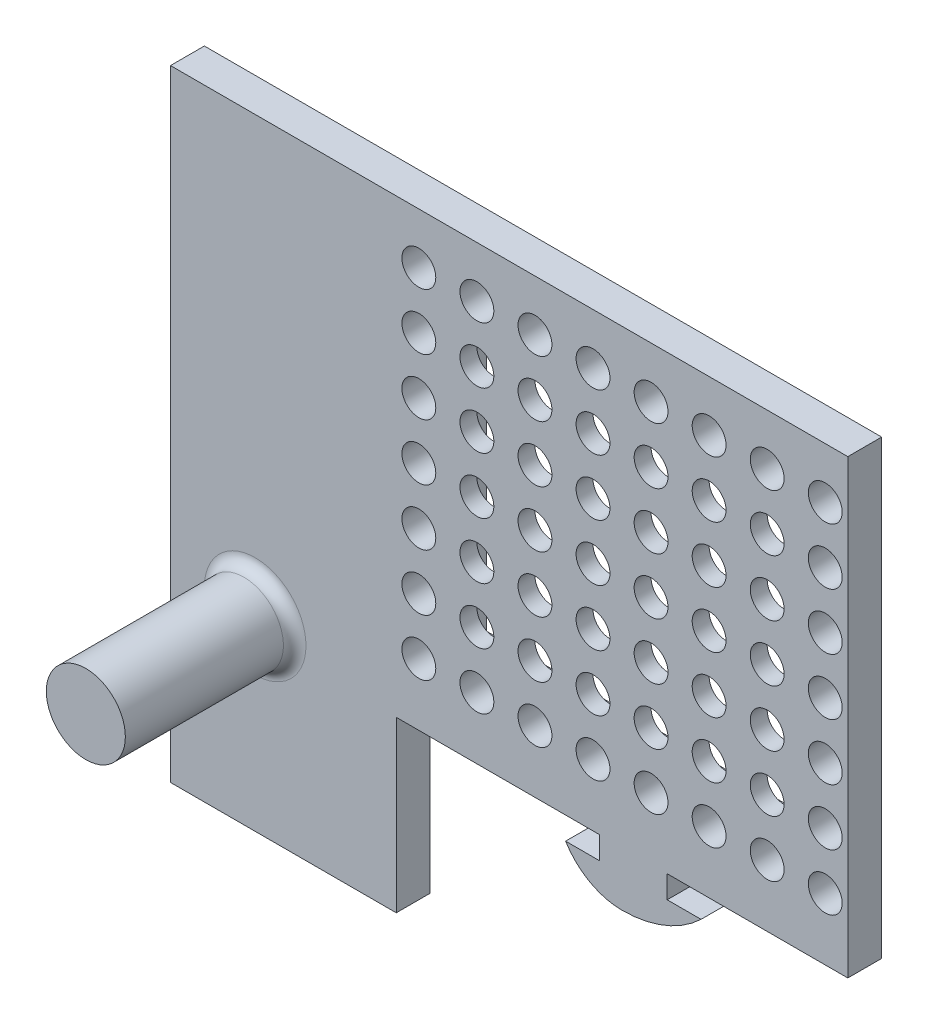
from build123d import *

# Parameters (mm, degrees)
BOSS_EXTRU_1_DEPTH      = 3
ESQUISSE2_R             = 1.5
ENL_V_MAT_EXTRU_1_DEPTH = 57.71860365
ESQUISSE3_R             = 3.5
BOSS_EXTRU_2_DEPTH      = 15
CONG_1_R                = 1
ESQUISSE4_W             = 30
ESQUISSE4_H             = 24.796786232
ENL_V_MAT_EXTRU_3_DEPTH = 1.5


with BuildPart() as part:
    # Esquisse1 → Boss.-Extru.1 (new body)
    with BuildSketch(Plane.XY):
        with BuildLine():
            Line((-18, 2), (0, 2))
            Line((0, 2), (0, 0))
            Line((0, 0), (-3, 0))
            ThreePointArc((-3, 0), (-0.866196648, -2.054890525), (2, -2.803628523))
            ThreePointArc((2, -2.803628523), (5.770289541, -2.076663576), (9, 0))
            Line((9, 0), (6, 0))
            Line((6, 0), (6, 2))
            Line((6, 2), (22, 2))
            Line((22, 2), (22, 42))
            Line((22, 42), (-18, 42))
            Line((-18, 42), (-38, 42))
            Line((-38, 42), (-38, -13))
            Line((-38, -13), (-18, -13))
            Line((-18, -13), (-18, 2))
        make_face()
    extrude(amount=BOSS_EXTRU_1_DEPTH)

    # Esquisse2 → Enlèv. mat.-Extru.1 (cut, through all)
    with BuildSketch(Plane.XY.offset(3)):
        with Locations((-16, 37.48988726)):
            Circle(ESQUISSE2_R)
        with Locations((-10.857142857, 37.48988726)):
            Circle(ESQUISSE2_R)
        with Locations((-5.714285714, 37.48988726)):
            Circle(ESQUISSE2_R)
        with Locations((-0.571428571, 37.48988726)):
            Circle(ESQUISSE2_R)
        with Locations((4.571428571, 37.48988726)):
            Circle(ESQUISSE2_R)
        with Locations((9.714285714, 37.48988726)):
            Circle(ESQUISSE2_R)
        with Locations((14.857142857, 37.48988726)):
            Circle(ESQUISSE2_R)
        with Locations((20, 37.48988726)):
            Circle(ESQUISSE2_R)
        with Locations((-10.857142857, 32.48988726)):
            Circle(ESQUISSE2_R)
        with Locations((-5.714285714, 32.48988726)):
            Circle(ESQUISSE2_R)
        with Locations((-0.571428571, 32.48988726)):
            Circle(ESQUISSE2_R)
        with Locations((4.571428571, 32.48988726)):
            Circle(ESQUISSE2_R)
        with Locations((9.714285714, 32.48988726)):
            Circle(ESQUISSE2_R)
        with Locations((14.857142857, 32.48988726)):
            Circle(ESQUISSE2_R)
        with Locations((-10.857142857, 27.48988726)):
            Circle(ESQUISSE2_R)
        with Locations((-5.714285714, 27.48988726)):
            Circle(ESQUISSE2_R)
        with Locations((-0.571428571, 27.48988726)):
            Circle(ESQUISSE2_R)
        with Locations((4.571428571, 27.48988726)):
            Circle(ESQUISSE2_R)
        with Locations((9.714285714, 27.48988726)):
            Circle(ESQUISSE2_R)
        with Locations((14.857142857, 27.48988726)):
            Circle(ESQUISSE2_R)
        with Locations((-10.857142857, 22.48988726)):
            Circle(ESQUISSE2_R)
        with Locations((-5.714285714, 22.48988726)):
            Circle(ESQUISSE2_R)
        with Locations((-0.571428571, 22.48988726)):
            Circle(ESQUISSE2_R)
        with Locations((4.571428571, 22.48988726)):
            Circle(ESQUISSE2_R)
        with Locations((9.714285714, 22.48988726)):
            Circle(ESQUISSE2_R)
        with Locations((14.857142857, 22.48988726)):
            Circle(ESQUISSE2_R)
        with Locations((-10.857142857, 17.48988726)):
            Circle(ESQUISSE2_R)
        with Locations((-5.714285714, 17.48988726)):
            Circle(ESQUISSE2_R)
        with Locations((-0.571428571, 17.48988726)):
            Circle(ESQUISSE2_R)
        with Locations((4.571428571, 17.48988726)):
            Circle(ESQUISSE2_R)
        with Locations((9.714285714, 17.48988726)):
            Circle(ESQUISSE2_R)
        with Locations((14.857142857, 17.48988726)):
            Circle(ESQUISSE2_R)
        with Locations((-10.857142857, 12.48988726)):
            Circle(ESQUISSE2_R)
        with Locations((-5.714285714, 12.48988726)):
            Circle(ESQUISSE2_R)
        with Locations((-0.571428571, 12.48988726)):
            Circle(ESQUISSE2_R)
        with Locations((4.571428571, 12.48988726)):
            Circle(ESQUISSE2_R)
        with Locations((9.714285714, 12.48988726)):
            Circle(ESQUISSE2_R)
        with Locations((14.857142857, 12.48988726)):
            Circle(ESQUISSE2_R)
        with Locations((-10.857142857, 7.48988726)):
            Circle(ESQUISSE2_R)
        with Locations((-5.714285714, 7.48988726)):
            Circle(ESQUISSE2_R)
        with Locations((-0.571428571, 7.48988726)):
            Circle(ESQUISSE2_R)
        with Locations((4.571428571, 7.48988726)):
            Circle(ESQUISSE2_R)
        with Locations((9.714285714, 7.48988726)):
            Circle(ESQUISSE2_R)
        with Locations((14.857142857, 7.48988726)):
            Circle(ESQUISSE2_R)
        with Locations((-16, 32.48988726)):
            Circle(ESQUISSE2_R)
        with Locations((-16, 27.48988726)):
            Circle(ESQUISSE2_R)
        with Locations((-16, 22.48988726)):
            Circle(ESQUISSE2_R)
        with Locations((-16, 17.48988726)):
            Circle(ESQUISSE2_R)
        with Locations((-16, 12.48988726)):
            Circle(ESQUISSE2_R)
        with Locations((-16, 7.48988726)):
            Circle(ESQUISSE2_R)
        with Locations((20, 32.48988726)):
            Circle(ESQUISSE2_R)
        with Locations((20, 27.48988726)):
            Circle(ESQUISSE2_R)
        with Locations((20, 22.48988726)):
            Circle(ESQUISSE2_R)
        with Locations((20, 17.48988726)):
            Circle(ESQUISSE2_R)
        with Locations((20, 12.48988726)):
            Circle(ESQUISSE2_R)
        with Locations((20, 7.48988726)):
            Circle(ESQUISSE2_R)
    extrude(amount=-ENL_V_MAT_EXTRU_1_DEPTH, mode=Mode.SUBTRACT)

    # Esquisse3 → Boss.-Extru.2 (add)
    with BuildSketch(Plane.XY.offset(3)):
        with Locations(Location((-30.5, 3.5, 0), (0, 0, 180))):
            Circle(ESQUISSE3_R)
    extrude(amount=BOSS_EXTRU_2_DEPTH)

    # Congé1
    cong_1_edges = [part.edges().sort_by_distance(p)[0] for p in [
        (-27, 3.5, 3),
    ]]
    fillet(cong_1_edges, radius=CONG_1_R)

    # Esquisse4 → Enlèv. mat.-Extru.3 (cut)
    with BuildSketch(Plane.XY):
        with Locations((2, 22)):
            Rectangle(ESQUISSE4_W, ESQUISSE4_H)
    extrude(amount=ENL_V_MAT_EXTRU_3_DEPTH, mode=Mode.SUBTRACT)


solid = part.part
